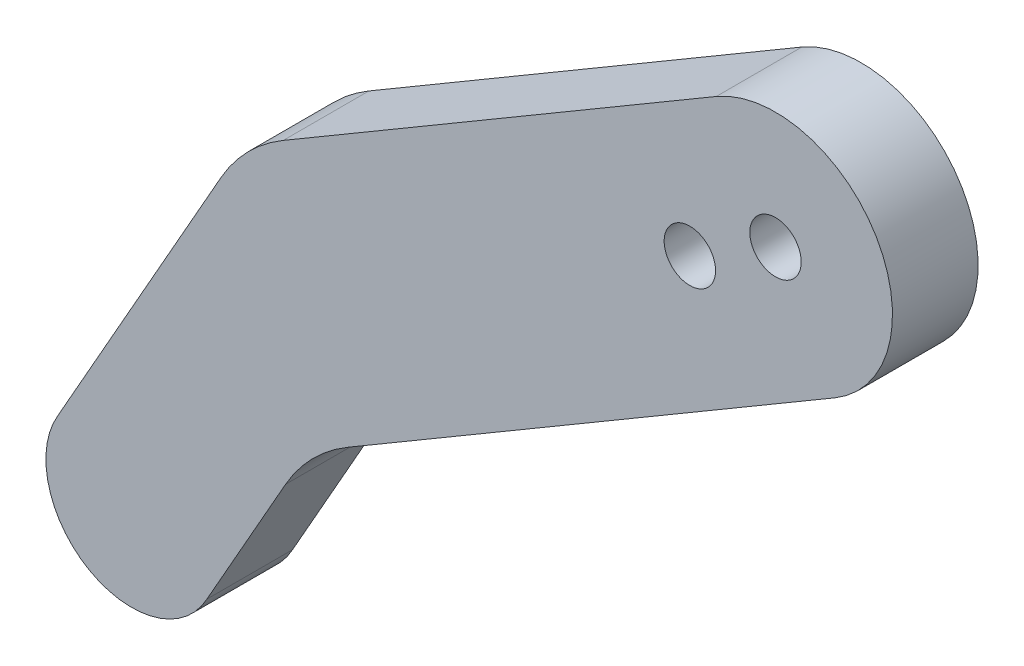
from build123d import *

# Parameters (mm, degrees)
BOSS_EXTRUDE1_DEPTH = 5
SKETCH4_R           = 1.5
CUT_EXTRUDE1_DEPTH  = 7


with BuildPart() as part:
    # Sketch3 → Boss-Extrude1 (new body)
    with BuildSketch(Plane.XY):
        with BuildLine():
            Line((0, 0), (9.528804476, 16.807257883))
            ThreePointArc((9.528804476, 16.807257883), (11.101707988, 18.890718774), (13.160255471, 20.496090072))
            Line((13.160255471, 20.496090072), (38.436867059, 35.354929207))
            ThreePointArc((38.436867059, 35.354929207), (47.786303491, 32.928139434), (45.359513719, 23.578703003))
            Line((45.359513719, 23.578703003), (16.927471829, 6.864946286))
            ThreePointArc((16.927471829, 6.864946286), (14.868924346, 5.259574989), (13.296020834, 3.176114098))
            Line((13.296020834, 3.176114098), (8.699180072, -4.931963714))
            ThreePointArc((8.699180072, -4.931963714), (1.838948591, -6.894344126), (0, 0))
        make_face()
    extrude(amount=BOSS_EXTRUDE1_DEPTH)

    # Sketch4 → Cut-Extrude1 (cut)
    with BuildSketch(Plane.XY.offset(5)):
        with Locations((41.898190389, 29.466816105)):
            Circle(SKETCH4_R)
        with Locations((36.898190389, 26.527569465)):
            Circle(SKETCH4_R)
    extrude(amount=-CUT_EXTRUDE1_DEPTH, mode=Mode.SUBTRACT)


solid = part.part
